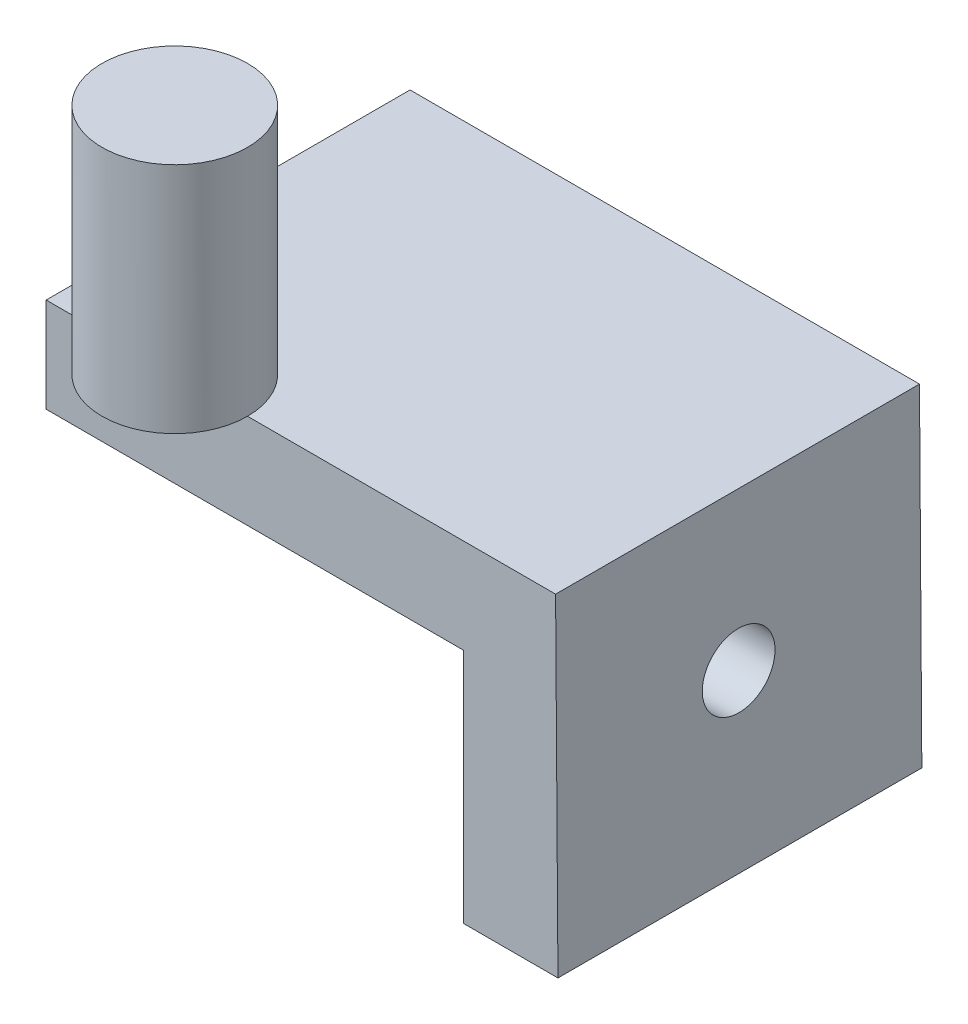
from build123d import *

# Parameters (mm, degrees)
SALIENTE_EXTRUIR1_DEPTH = 12.5
CROQUIS5_R              = 2.5
CORTAR_EXTRUIR1_DEPTH   = 25
CROQUIS15_W             = 5
CROQUIS15_H             = 16


with BuildPart() as part:
    # Croquis1 → Saliente-Extruir1 (new, symmetric)
    with BuildSketch(Plane.XY):
        Polygon((-35.162289575, 0), (-0.162289575, 0), (0, -22.757556118), (-6.5, -22.757556118), (-6.5, -6.5), (-35.162289575, -6.5), align=None)
    extrude(amount=SALIENTE_EXTRUIR1_DEPTH, both=True)

    # Croquis5 → Cortar-Extruir1 (cut)
    with BuildSketch(Plane(origin=(-0.162281322, -0.001157267, 0), x_dir=(0, 0, -1), z_dir=(0.9999745736838829, 0.007131057827339795, 0))):
        with Locations(Location((0, -10.756977477, 0), (0, 0, 90))):
            Circle(CROQUIS5_R)
    extrude(amount=-CORTAR_EXTRUIR1_DEPTH, mode=Mode.SUBTRACT)

    # Croquis15 → Revolución2 (revolve)
    with BuildSketch(Plane.XY.offset(12.5), mode=Mode.PRIVATE) as revoluci_n2_sk:
        with Locations((-23.826251853, 8)):
            Rectangle(CROQUIS15_W, CROQUIS15_H)
    revolve(revoluci_n2_sk.sketch.rotate(Axis((-26.326251853, 0, 12.5), (0, 1, 0)), 90), axis=Axis((-26.326251853, 0, 12.5), (0, 1, 0)))


solid = part.part
